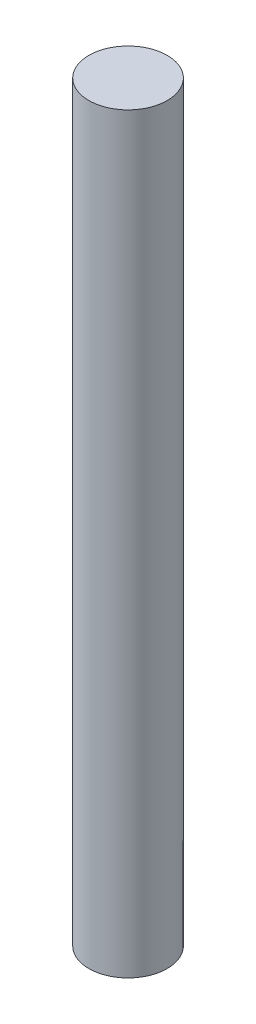
from build123d import *

# Parameters (mm, degrees)
SKETCH1_R           = 15.875
BOSS_EXTRUDE1_DEPTH = 304.8


with BuildPart() as part:
    # Sketch1 → Boss-Extrude1 (new body)
    with BuildSketch(Plane(origin=(0, 0, 0), x_dir=(1, 0, 0), z_dir=(0, 1, 0))):
        with Locations(Location((0, 0, 0), (0, 0, 90))):
            Circle(SKETCH1_R)
    extrude(amount=BOSS_EXTRUDE1_DEPTH)


solid = part.part
